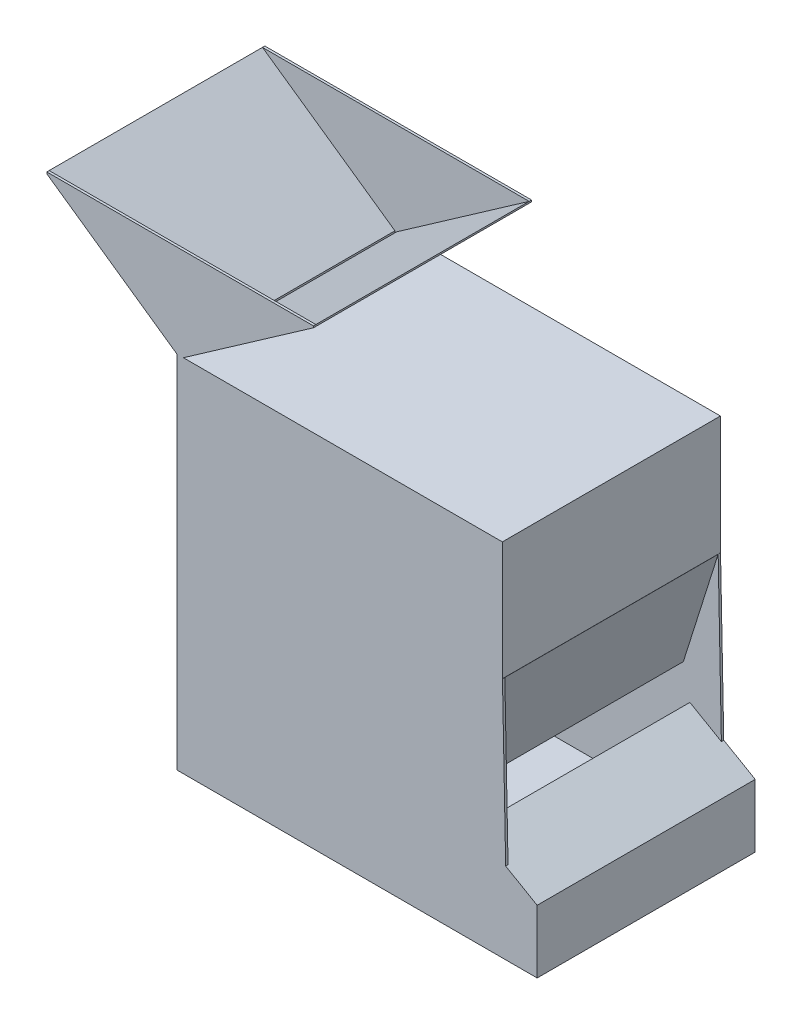
from build123d import *

# Parameters (mm, degrees)
EXTRUDE_3_DEPTH          = 180
EXTRUDE_4_DEPTH          = 2
EXTRUDE_5_DEPTH          = 180
CUT_EXTRUDE_8_DEPTH      = 6
CUT_EXTRUDE_8_DEPTH_BACK = 14
SKETCH_10_R              = 2.5
SKETCH_10_R_2            = 6
CUT_EXTRUDE_9_DEPTH      = 180
SKETCH_11_W              = 274.631033311
SKETCH_11_H              = 184
SKETCH_11_W_2            = 270.631033311
SKETCH_11_H_2            = 180
EXTRUDE_1_DEPTH          = 100
EXTRUDE_6_REACH          = 466.254
EXTRUDE_7_DEPTH          = 180
EXTRUDE_8_DEPTH          = 2
EXTRUDE_9_REACH          = 520.498
SKETCH_15_W              = 267.131033311
SKETCH_15_H              = 2


with BuildPart() as part:
    # 草图1 → 凸台-拉伸3 (new body)
    with BuildSketch(Plane.XY):
        with BuildLine():
            Line((300, 0), (0, 0))
            Line((0, 0), (0, 200))
            Line((0, 200), (270, 200))
            Line((270, 200), (241.796905997, 110.612978654))
            ThreePointArc((241.796905997, 110.612978654), (242.584644274, 109.746742593), (243.337981207, 108.850427931))
            Line((243.337981207, 108.850427931), (272.728222629, 202))
            Line((272.728222629, 202), (-2, 202))
            Line((-2, 202), (-2, -2))
            Line((-2, -2), (302, -2))
            Line((302, -2), (302, 51.154700538))
            Line((302, 51.154700538), (248.866473036, 81.831356634))
            ThreePointArc((248.866473036, 81.831356634), (248.571049064, 80.851494363), (248.242374569, 79.882278975))
            Line((248.242374569, 79.882278975), (300, 50))
            Line((300, 50), (300, 0))
        make_face()
    extrude(amount=EXTRUDE_3_DEPTH)

    # 草图7 → 凸台-拉伸4 (add)
    with BuildSketch(Plane(origin=(0, 0, 0), x_dir=(-1, 0, 0), z_dir=(0, 0, -1))):
        Polygon((-272.728222629, 202), (-275.433236518, 66.493028586), (-302, 51.154700538), (-302, -2), (2, -2), (2, 202), align=None)
    extrude_4 = extrude(amount=EXTRUDE_4_DEPTH)

    # 镜向5: 凸台-拉伸4 across plane
    add(extrude_4.mirror(Plane.XY.offset(90)))

    # 草图8 → 凸台-拉伸5 (add)
    with BuildSketch(Plane.XY):
        with BuildLine():
            Line((191.022225211, 97.764571353), (0, 144.327661976))
            Line((0, 144.327661976), (0, 140.399780569))
            Line((0, 140.399780569), (190.270548779, 94.019916677))
            ThreePointArc((190.270548779, 94.019916677), (190.586734182, 95.904218314), (191.022225211, 97.764571353))
        make_face()
    extrude(amount=EXTRUDE_5_DEPTH)

    # 草图10 → 切除-拉伸8 (cut, two sides: drawn at the far end of the back side and taken through both)
    with BuildSketch(Plane.XY.offset(-CUT_EXTRUDE_8_DEPTH_BACK)):
        with Locations((60, 60)):
            Circle(SKETCH_10_R)
        with Locations((95, 60)):
            Circle(SKETCH_10_R_2)
    extrude(amount=CUT_EXTRUDE_8_DEPTH + CUT_EXTRUDE_8_DEPTH_BACK, mode=Mode.SUBTRACT)

    # 草图8<3> → 切除-拉伸9 (cut)
    with BuildSketch(Plane.XY):
        Polygon((0, 200), (270, 200), (270.631033311, 202), (0, 202), align=None)
    extrude(amount=CUT_EXTRUDE_9_DEPTH, mode=Mode.SUBTRACT)

    # 草图11 → 拉伸-薄壁1 (add)
    with BuildSketch(Plane(origin=(0, 202, 0), x_dir=(1, 0, 0), z_dir=(0, 1, 0))):
        with Locations((135.315516656, -90)):
            Rectangle(SKETCH_11_W, SKETCH_11_H)
        with Locations((135.315516656, -90)):
            Rectangle(SKETCH_11_W_2, SKETCH_11_H_2, mode=Mode.SUBTRACT)
    extrude(amount=EXTRUDE_1_DEPTH)

    # 草图12 → 凸台-拉伸6 (add, up to next)
    with BuildSketch(Plane(origin=(0, 0, 180), x_dir=(-1, 0, 0), z_dir=(0, 0, -1)), mode=Mode.PRIVATE) as extrude_6_sk1:
        Polygon((-1.5, 302), (-1.5, 272), (-1, 262), (-3.5, 272), (-3.5, 302), align=None)
    extrude_6_tool1 = extrude(extrude_6_sk1.sketch, amount=EXTRUDE_6_REACH, mode=Mode.PRIVATE) - part.part
    add(extrude_6_tool1.solids().sort_by_distance((2.428571, 284.380952, 180))[0])

    # 草图13 → 凸台-拉伸7 (add)
    with BuildSketch(Plane(origin=(0, 0, 180), x_dir=(-1, 0, 0), z_dir=(0, 0, -1))):
        Polygon((-1.5, 302), (-113.268775045, 380.148175953), (-113.268775045, 378.749785823), (-3.5, 302), align=None)
        Polygon((111.768775045, 378.749785823), (111.768775045, 380.148175953), (0, 302), (2, 302), align=None)
    extrude(amount=EXTRUDE_7_DEPTH)

    # 草图14 → 凸台-拉伸8 (add)
    with BuildSketch(Plane(origin=(0, 0, 0), x_dir=(-1, 0, 0), z_dir=(0, 0, -1))):
        Polygon((-113.268775045, 380.148175953), (111.768775045, 380.148175953), (111.768775045, 378.749785823), (2, 302), (-3.5, 302), (-113.268775045, 378.749785823), align=None)
    extrude_8 = extrude(amount=EXTRUDE_8_DEPTH)

    # 镜向6: 凸台-拉伸8 across plane
    add(extrude_8.mirror(Plane.XY.offset(90)))

    # 草图15 → 凸台-拉伸9 (add, up to next)
    with BuildSketch(Plane(origin=(0, 0, 180), x_dir=(-1, 0, 0), z_dir=(0, 0, -1)), mode=Mode.PRIVATE) as extrude_9_sk1:
        with Locations((-137.065516656, 301)):
            Rectangle(SKETCH_15_W, SKETCH_15_H)
    extrude_9_tool1 = extrude(extrude_9_sk1.sketch, amount=EXTRUDE_9_REACH, mode=Mode.PRIVATE) - part.part
    add(extrude_9_tool1.solids().sort_by_distance((137.065517, 301, 180))[0])


solid = part.part
